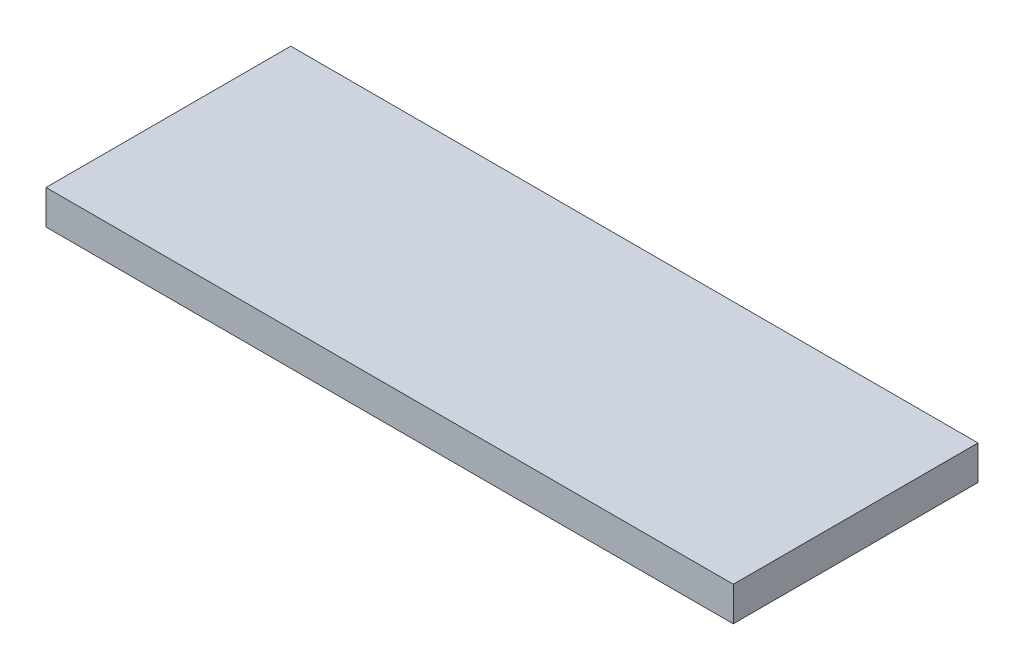
from build123d import *

# Parameters (mm, degrees)
SKETCH1_W           = 203.618586236
SKETCH1_H           = 72.506249342
BOSS_EXTRUDE1_DEPTH = 10.16


with BuildPart() as part:
    # Sketch1 → Boss-Extrude1 (new body)
    with BuildSketch(Plane(origin=(0, 0, 0), x_dir=(1, 0, 0), z_dir=(0, 1, 0))):
        Rectangle(SKETCH1_W, SKETCH1_H)
    extrude(amount=BOSS_EXTRUDE1_DEPTH)


solid = part.part
